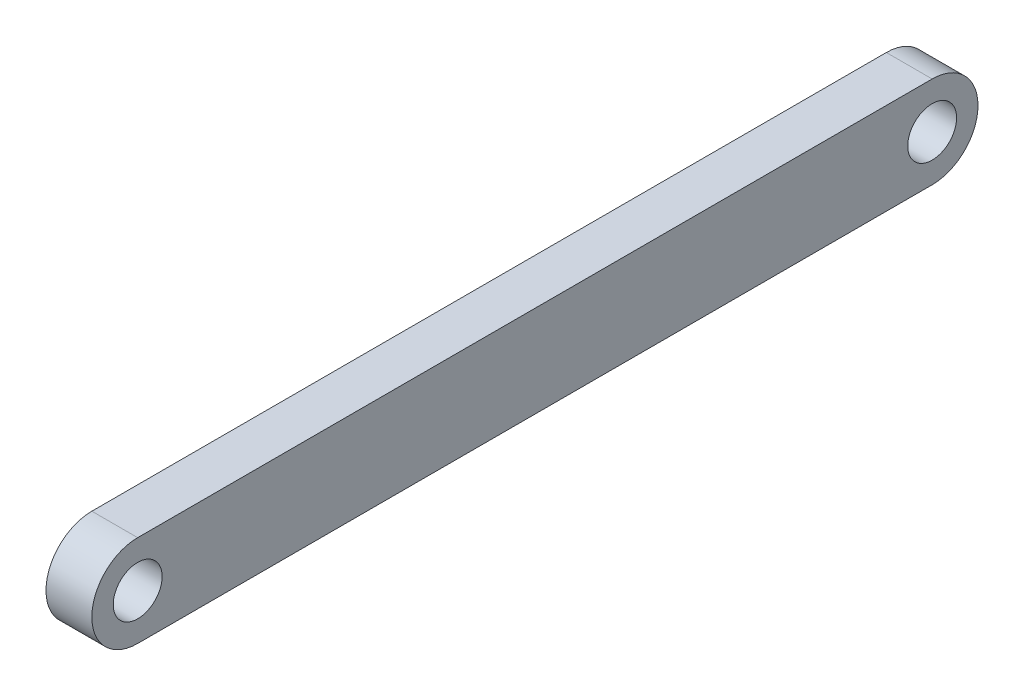
from build123d import *

# Parameters (mm, degrees)
SKETCH1_R           = 1.6
BOSS_EXTRUDE1_DEPTH = 3


with BuildPart() as part:
    # Sketch1 → Boss-Extrude1 (new body)
    with BuildSketch(Plane.YZ):
        with BuildLine():
            Line((-3, 52), (-3, 0))
            ThreePointArc((-3, 0), (0, -3), (3, 0))
            Line((3, 0), (3, 52))
            ThreePointArc((3, 52), (0, 55), (-3, 52))
        make_face()
        with Locations(Location((0, 52, 0), (0, 0, 270))):
            Circle(SKETCH1_R, mode=Mode.SUBTRACT)
        with Locations(Location((0, 0, 0), (0, 0, 270))):
            Circle(SKETCH1_R, mode=Mode.SUBTRACT)
    extrude(amount=BOSS_EXTRUDE1_DEPTH)


solid = part.part
